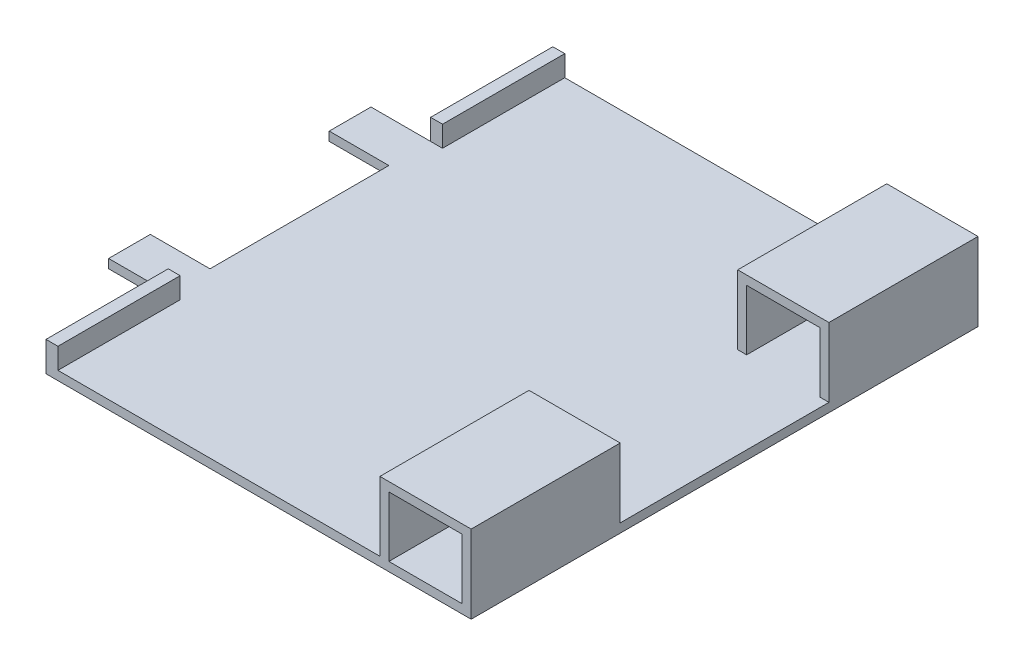
from build123d import *

# Parameters (mm, degrees)
BOSS_EXTRUDE2_DEPTH  = 1.5
SKETCH1_4_W          = 10
SKETCH1_4_H          = 7
BOSS_EXTRUDE3_DEPTH  = 1.5
SKETCH1_14_W         = 2
SKETCH1_14_H         = 20.5
BOSS_EXTRUDE11_DEPTH = 5
SKETCH1_16_W         = 1.5
SKETCH1_16_H         = 25
BOSS_EXTRUDE12_DEPTH = 11.6
SKETCH2_W            = 15.3
SKETCH2_H            = 25
BOSS_EXTRUDE13_DEPTH = 1.5


with BuildPart() as part:
    # Sketch1 → Boss-Extrude2 (new body)
    with BuildSketch(Plane(origin=(0, 0, 0), x_dir=(1, 0, 0), z_dir=(0, 1, 0))):
        Polygon((49.5, 70), (-4.5, 70), (-4.5, 49.5), (-6.5, 49.5), (-6.5, 42.5), (-6.5, 12.5), (-6.5, 5.5), (-4.5, 5.5), (-4.5, -15), (21.3, -15), (32.3, -15), (47.433426619, -15), (49.5, -15), (49.5, 10), (51, 10), (51, -15), (52.3, -15), (53.8, -15), (59.19614989, -15), (63.3, -15), (63.3, 10), (64.8, 10), (64.8, 11.5), (64.8, 45), (63.3, 45), (63.3, 70), (60.5, 70), (51, 70), (51, 45), (49.5, 45), align=None)
    extrude(amount=BOSS_EXTRUDE2_DEPTH)

    # Sketch1<4> → Boss-Extrude3 (add)
    with BuildSketch(Plane(origin=(0, 0, 0), x_dir=(1, 0, 0), z_dir=(0, 1, 0))):
        with Locations((-11.5, 46)):
            Rectangle(SKETCH1_4_W, SKETCH1_4_H)
        with Locations((-11.5, 9)):
            Rectangle(SKETCH1_4_W, SKETCH1_4_H)
    extrude(amount=BOSS_EXTRUDE3_DEPTH)

    # Sketch1<14> → Boss-Extrude11 (add)
    with BuildSketch(Plane(origin=(0, 0, 0), x_dir=(1, 0, 0), z_dir=(0, 1, 0))):
        with Locations((-5.5, 59.75)):
            Rectangle(SKETCH1_14_W, SKETCH1_14_H)
        with Locations((-5.5, -4.75)):
            Rectangle(SKETCH1_14_W, SKETCH1_14_H)
    extrude(amount=BOSS_EXTRUDE11_DEPTH)

    # Sketch1<16> → Boss-Extrude12 (add)
    with BuildSketch(Plane(origin=(0, 0, 0), x_dir=(1, 0, 0), z_dir=(0, 1, 0))):
        with Locations((50.25, 57.5)):
            Rectangle(SKETCH1_16_W, SKETCH1_16_H)
        with Locations((64.05, 57.5)):
            Rectangle(SKETCH1_16_W, SKETCH1_16_H)
        with Locations((64.05, -2.5)):
            Rectangle(SKETCH1_16_W, SKETCH1_16_H)
        with Locations((50.25, -2.5)):
            Rectangle(SKETCH1_16_W, SKETCH1_16_H)
    extrude(amount=BOSS_EXTRUDE12_DEPTH)

    # Sketch2 → Boss-Extrude13 (add)
    with BuildSketch(Plane(origin=(0, 11.6, 0), x_dir=(1, 0, 0), z_dir=(0, 1, 0))):
        with Locations((57.15, 57.5)):
            Rectangle(SKETCH2_W, SKETCH2_H)
        with Locations((57.15, -2.5)):
            Rectangle(SKETCH2_W, SKETCH2_H)
    extrude(amount=BOSS_EXTRUDE13_DEPTH)


solid = part.part
